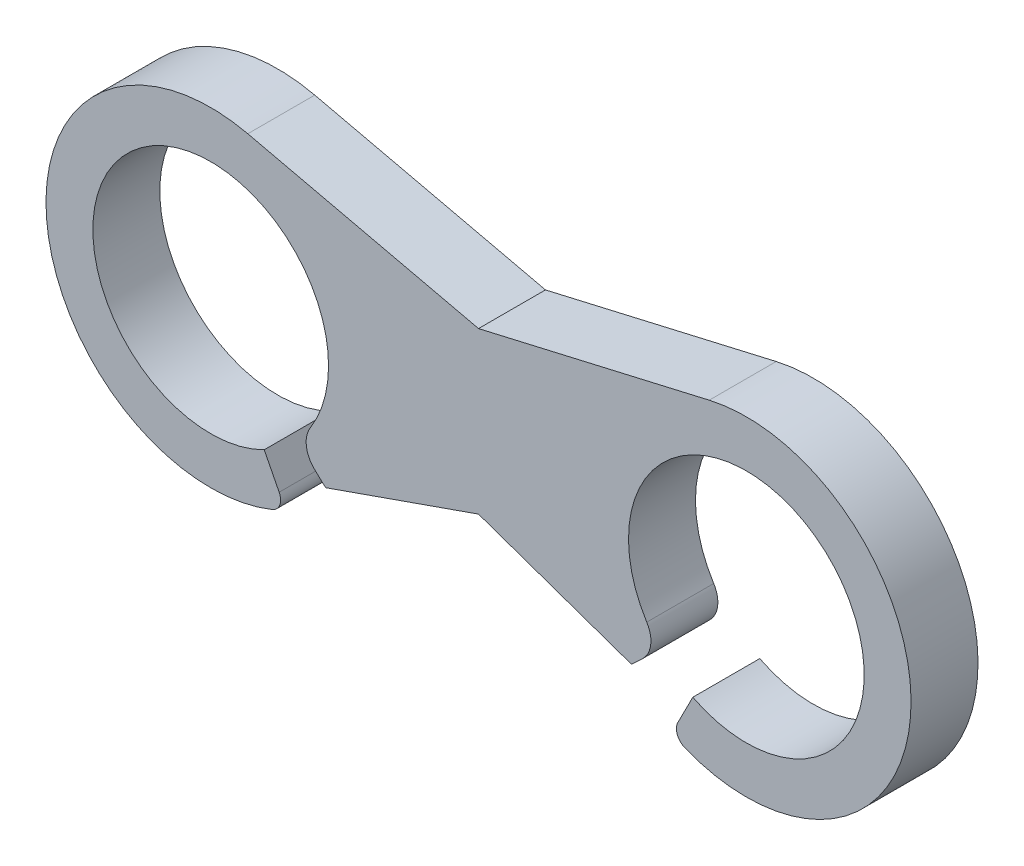
from build123d import *

# Parameters (mm, degrees)
BOSS_EXTRUDE1_DEPTH = 2.5
FILLET1_R           = 0.5
FILLET2_R           = 1


with BuildPart() as part:
    # Sketch1 → Boss-Extrude1 (new body)
    with BuildSketch(Plane.XY):
        with BuildLine():
            Line((0, 4), (8.614511907, 5.991904768))
            ThreePointArc((8.614511907, 5.991904768), (16.104194038, -0.749209679), (7.206608675, -5.479002182))
            Line((7.206608675, -5.479002182), (8.001476125, -3.91993652))
            ThreePointArc((8.001476125, -3.91993652), (12.64885164, 3.513343848), (6.781304612, -3))
            Line((6.781304612, -3), (5.708406149, -4))
            Line((5.708406149, -4), (0, -2))
            Line((0, -2), (0, 4))
        make_face()
    boss_extrude1 = extrude(amount=BOSS_EXTRUDE1_DEPTH)

    # Mirror1: Boss-Extrude1 across plane
    add(boss_extrude1.mirror(Plane(origin=(0, 4, 2.5), x_dir=(0, 0, 1), z_dir=(1, 0, 0))))

    # Fillet1
    fillet1_edges = [part.edges().sort_by_distance(p)[0] for p in [
        (7.206608675, -5.479002182, 1.25),
        (-7.206608675, -5.479002182, 1.25),
    ]]
    fillet(fillet1_edges, radius=FILLET1_R)

    # Fillet2
    fillet2_edges = [part.edges().sort_by_distance(p)[0] for p in [
        (6.781304612, -3, 1.25),
        (-6.781304612, -3, 1.25),
    ]]
    fillet(fillet2_edges, radius=FILLET2_R)


solid = part.part
